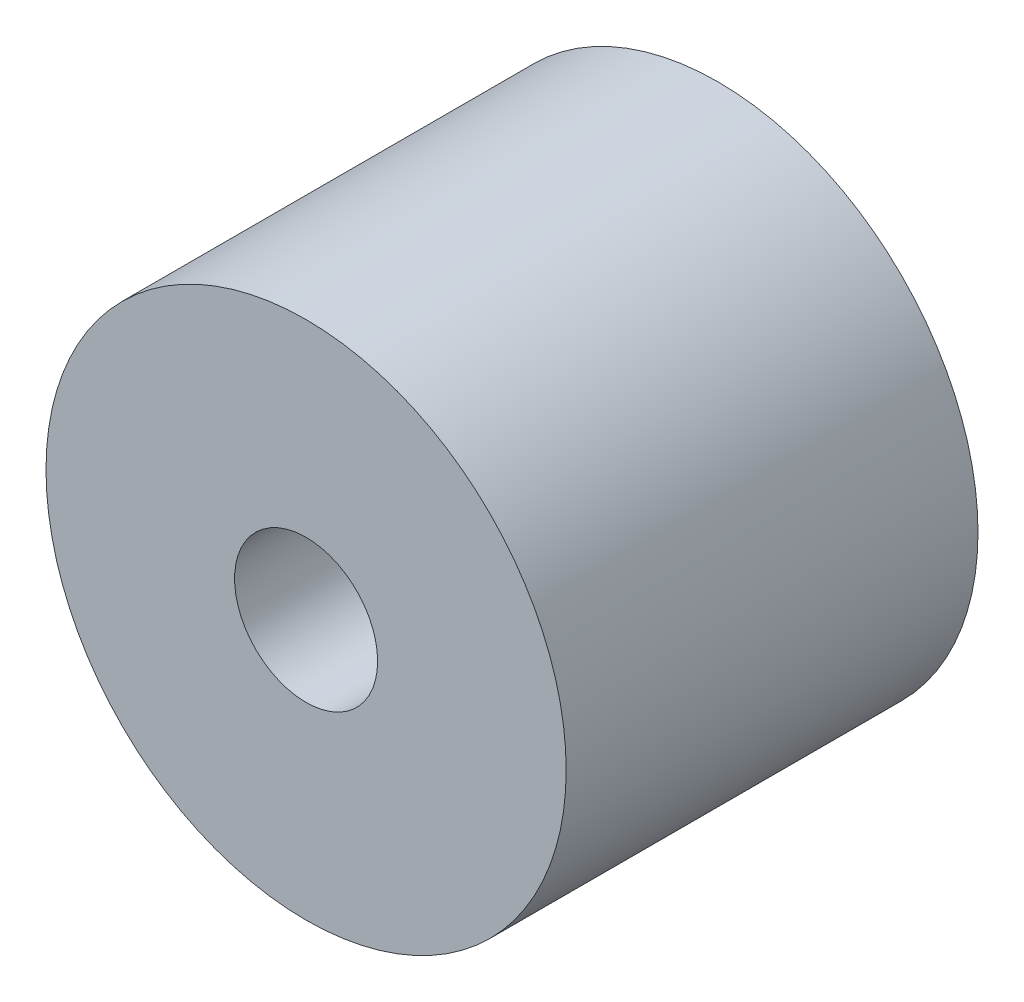
from build123d import *

# Parameters (mm, degrees)
SKETCH_1_R      = 6
SKETCH_1_R_2    = 1.65
EXTRUDE_1_DEPTH = 9.5


with BuildPart() as part:
    # 草图1 → 凸台-拉伸1 (new body)
    with BuildSketch(Plane.XY):
        Circle(SKETCH_1_R)
        Circle(SKETCH_1_R_2, mode=Mode.SUBTRACT)
    extrude(amount=EXTRUDE_1_DEPTH)


solid = part.part
